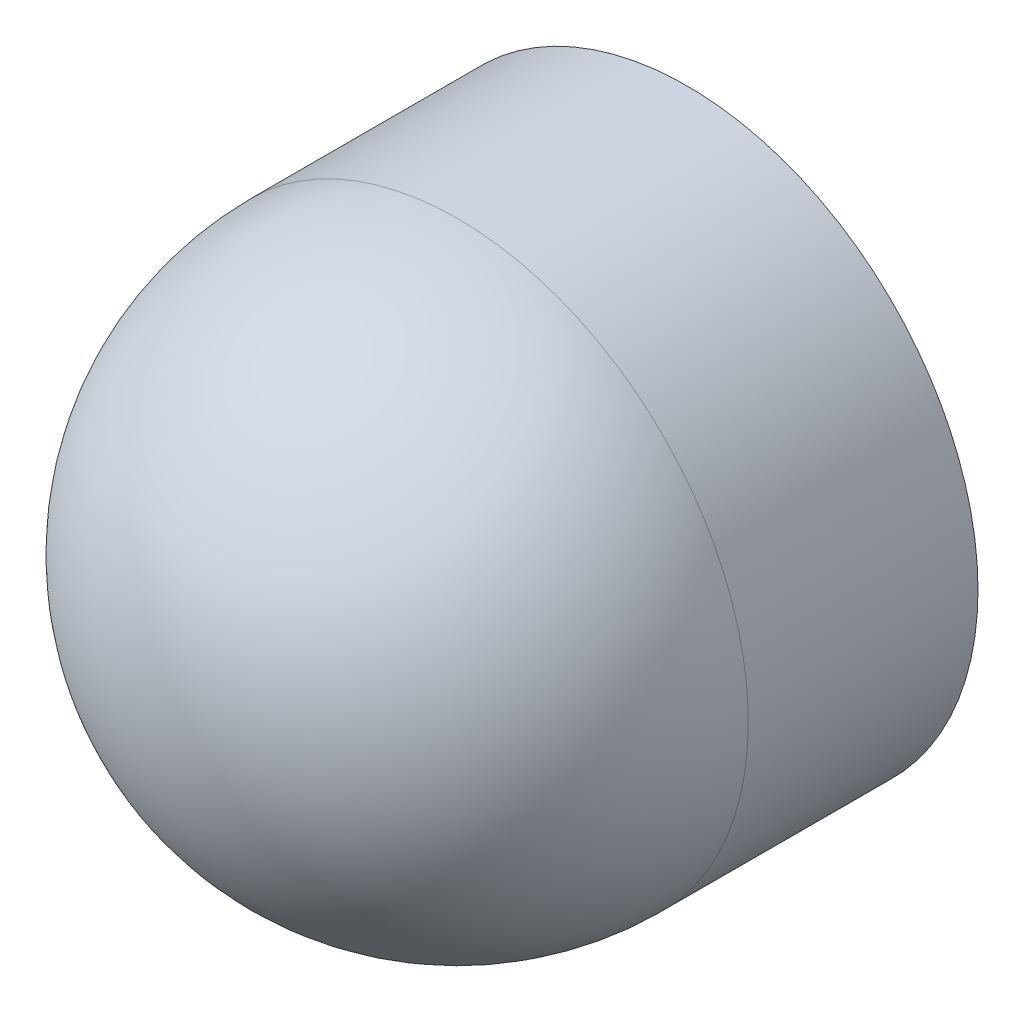
from build123d import *


with BuildPart() as part:
    # Sketch1 → Revolve1 (revolve)
    with BuildSketch(Plane.YZ, mode=Mode.PRIVATE) as revolve1_sk:
        with BuildLine():
            Line((0, 7.62), (0, 17.272))
            ThreePointArc((0, 17.272), (6.824994652, 14.444994652), (9.652, 7.62))
            Line((9.652, 7.62), (9.652, 0))
            Line((9.652, 0), (0, 0))
            Line((0, 0), (0, 7.62))
        make_face()
    revolve(revolve1_sk.sketch.rotate(Axis((0, 0, 7.62), (0, 0, 1)), 90), axis=Axis((0, 0, 7.62), (0, 0, 1)))


solid = part.part
